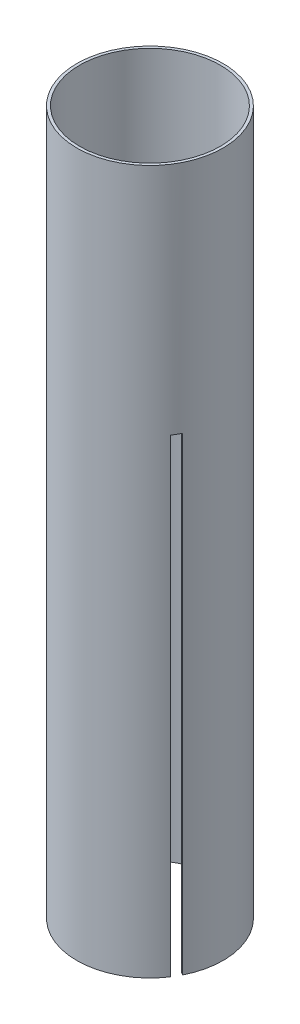
from build123d import *

# Parameters (mm, degrees)
SKETCH1_R           = 39.624
SKETCH1_R_2         = 38.1
BOSS_EXTRUDE1_DEPTH = 381
SKETCH2_W           = 4.7625
SKETCH2_H           = 254
CUT_EXTRUDE1_DEPTH  = 386.098848027
CIRPATTERN1_COUNT   = 3


with BuildPart() as part:
    # Sketch1 → Boss-Extrude1 (new body)
    with BuildSketch(Plane(origin=(0, 0, 0), x_dir=(1, 0, 0), z_dir=(0, 1, 0))):
        with Locations(Location((0, 0, 0), (0, 0, 270))):
            Circle(SKETCH1_R)
        with Locations(Location((0, 0, 0), (0, 0, 270))):
            Circle(SKETCH1_R_2, mode=Mode.SUBTRACT)
    extrude(amount=BOSS_EXTRUDE1_DEPTH)

    # Sketch2 → Cut-Extrude1 (cut, through all)
    with BuildSketch(Plane.XY):
        with Locations((0, 127)):
            Rectangle(SKETCH2_W, SKETCH2_H)
    cut_extrude1 = extrude(amount=-CUT_EXTRUDE1_DEPTH, mode=Mode.SUBTRACT)

    # CirPattern1: Cut-Extrude1 ×3 about axis
    cirpattern1_axis = Axis((0, 0, 0), (0, 1, 0))
    for i in range(1, CIRPATTERN1_COUNT):
        add(cut_extrude1.rotate(cirpattern1_axis, i * 360 / CIRPATTERN1_COUNT), mode=Mode.SUBTRACT)


solid = part.part
